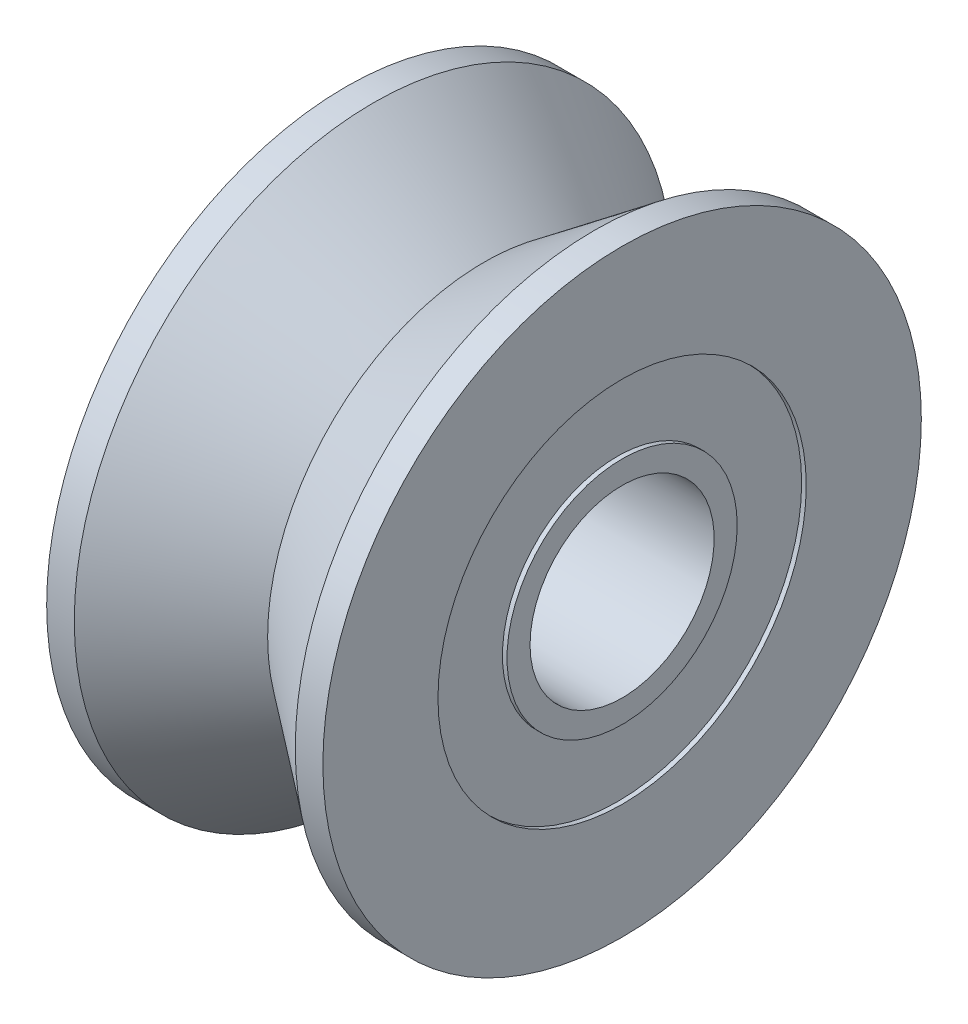
from build123d import *

# Parameters (mm, degrees)
SKETCH2_R          = 4
SKETCH2_R_2        = 2.5
CUT_EXTRUDE1_DEPTH = 0.1


with BuildPart() as part:
    # Sketch1 → Revolve1 (revolve)
    with BuildSketch(Plane.XY, mode=Mode.PRIVATE) as revolve1_sk:
        Polygon((-3, 2), (3, 2), (3, 6.5), (2.4, 6.5), (0, 4.7), (-2.4, 6.5), (-3, 6.5), align=None)
    revolve(revolve1_sk.sketch.rotate(Axis((0, 0, 0), (1, 0, 0)), 90), axis=Axis((0, 0, 0), (1, 0, 0)))

    # Sketch2 → Cut-Extrude1 (cut)
    with BuildSketch(Plane(origin=(3, 0, 0), x_dir=(0, 0, -1), z_dir=(1, 0, 0))):
        Circle(SKETCH2_R)
        Circle(SKETCH2_R_2, mode=Mode.SUBTRACT)
    cut_extrude1 = extrude(amount=-CUT_EXTRUDE1_DEPTH, mode=Mode.SUBTRACT)

    # Mirror1: Cut-Extrude1 across plane
    add(cut_extrude1.mirror(Plane(origin=(0, 0, 0), x_dir=(0, 0, 1), z_dir=(1, 0, 0))), mode=Mode.SUBTRACT)


solid = part.part
